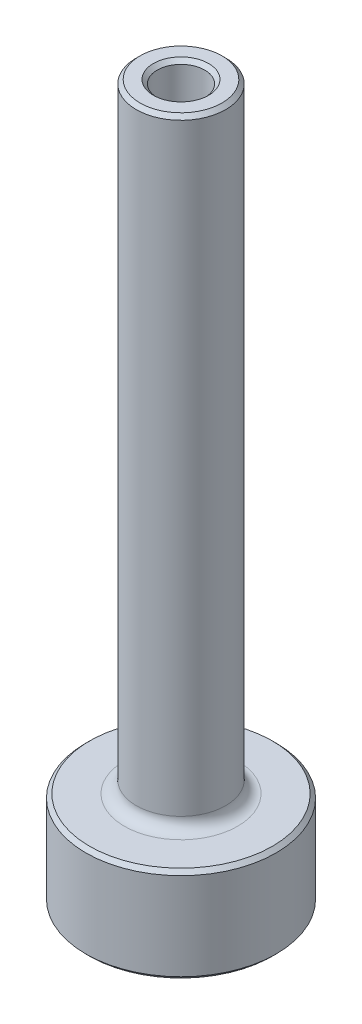
from build123d import *

# Parameters (mm, degrees)
CUT_EXTRUDE1_DEPTH = 3.175
FILLET1_R          = 0.79375
CHAMFER1_SIZE      = 0.254


with BuildPart() as part:
    # Sketch1 → Revolve1 (revolve)
    with BuildSketch(Plane.XY, mode=Mode.PRIVATE) as revolve1_sk:
        Polygon((3.175, 0), (6.35, 0), (6.35, 6.35), (2.9845, 6.35), (2.9845, 47.625), (1.5875, 47.625), (1.5875, 3.175), (3.175, 3.175), align=None)
    revolve(revolve1_sk.sketch.rotate(Axis((0, 5.569325848, 0), (0, -1, 0)), 180), axis=Axis((0, 5.569325848, 0), (0, -1, 0)))

    # Sketch2 → Cut-Extrude1 (cut)
    with BuildSketch(Plane.XZ):
        Polygon((1.833087105, 3.175), (-1.833087105, 3.175), (-3.666174209, 0), (-1.833087105, -3.175), (1.833087105, -3.175), (3.666174209, 0), align=None)
    extrude(amount=-CUT_EXTRUDE1_DEPTH, mode=Mode.SUBTRACT)

    # Fillet1
    fillet1_edges = [part.edges().sort_by_distance(p)[0] for p in [
        (0, 3.175, 3.175),
        (-2.749630657, 3.175, 1.5875),
        (-2.749630657, 3.175, -1.5875),
        (0, 3.175, -3.175),
        (2.749630657, 3.175, -1.5875),
        (2.749630657, 3.175, 1.5875),
        (-1.833087105, 1.5875, 3.175),
        (-3.666174209, 1.5875, 0),
        (-1.833087105, 1.5875, -3.175),
        (1.833087105, 1.5875, -3.175),
        (3.666174209, 1.5875, 0),
        (1.833087105, 1.5875, 3.175),
        (2.9845, 6.35, 0),
    ]]
    fillet(fillet1_edges, radius=FILLET1_R)

    # Chamfer1
    chamfer1_edges = [part.edges().sort_by_distance(p)[0] for p in [
        (1.5875, 3.175, 0),
        (0, 0, 3.175),
        (2.749630657, 0, 1.5875),
        (1.5875, 47.625, 0),
        (2.749630657, 0, -1.5875),
        (0, 0, -3.175),
        (2.9845, 47.625, 0),
        (-2.749630657, 0, -1.5875),
        (-2.749630657, 0, 1.5875),
        (-1.771690329, 0, 3.068657664),
        (1.771690329, 0, 3.068657664),
        (3.543380657, 0, 0),
        (1.771690329, 0, -3.068657664),
        (-1.771690329, 0, -3.068657664),
        (-3.543380657, 0, 0),
        (6.35, 6.35, 0),
        (6.35, 0, 0),
    ]]
    chamfer(chamfer1_edges, length=CHAMFER1_SIZE)


solid = part.part
